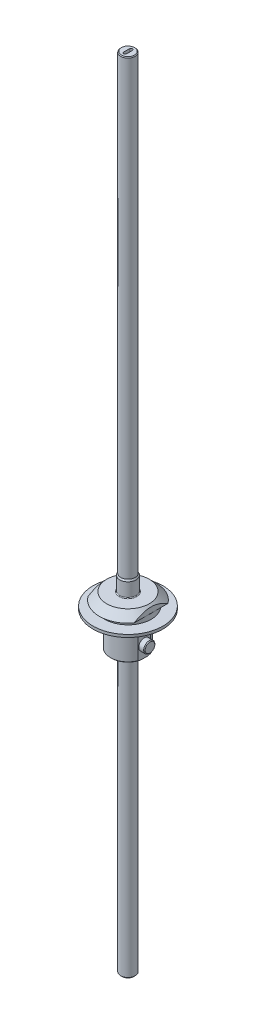
from build123d import *

# Parameters (mm, degrees)
CHAMFER1_SIZE       = 0.254
CUT_EXTRUDE3_DEPTH  = 3.81
SKETCH5_R           = 0.9525
BOSS_EXTRUDE1_DEPTH = 3.7592
CUT_EXTRUDE1_DEPTH  = 137.608260621
CHAMFER2_SIZE       = 0.127
CUT_EXTRUDE4_REACH  = 83.566
FILLET1_R           = 0.508
FILLET2_R           = 0.127


with BuildPart() as part:
    # Sketch1 → Revolve1 (revolve)
    with BuildSketch(Plane.XY, mode=Mode.PRIVATE) as revolve1_sk:
        Polygon((0, 82.4738), (1.23825, 82.4738), (1.23825, 2.5908), (3.6322, 2.5908), (4.8768, 1.3462), (3.96875, 1.3462), (3.96875, 0.4572), (5.969, 0.4572), (5.969, 0), (2.9845, 0), (2.9845, -5.842), (1.23825, -5.842), (1.23825, -53.8734), (0, -53.8734), align=None)
    revolve(revolve1_sk.sketch.rotate(Axis((0, 82.4738, 0), (0, -1, 0)), 180), axis=Axis((0, 82.4738, 0), (0, -1, 0)))

    # Chamfer1
    chamfer1_edges = [part.edges().sort_by_distance(p)[0] for p in [
        (1.23825, -53.8734, 0),
    ]]
    chamfer(chamfer1_edges, length=CHAMFER1_SIZE)

    # Sketch4 → Cut-Extrude3 (cut)
    with BuildSketch(Plane.XZ.offset(5.842)):
        with BuildLine():
            Line((-2.794, 1.049192189), (-2.794, -1.049192189))
            ThreePointArc((-2.794, -1.049192189), (-2.9845, 0), (-2.794, 1.049192189))
        make_face()
        with BuildLine():
            Line((2.794, 1.049192189), (2.794, -1.049192189))
            ThreePointArc((2.794, -1.049192189), (2.9845, 0), (2.794, 1.049192189))
        make_face()
    extrude(amount=-CUT_EXTRUDE3_DEPTH, mode=Mode.SUBTRACT)

    # Sketch5 → Boss-Extrude1 (add, symmetric)
    with BuildSketch(Plane(origin=(0, 0, 0), x_dir=(0, 0, -1), z_dir=(1, 0, 0))):
        with Locations(Location((0, -3.81, 0), (0, 0, 180))):
            Circle(SKETCH5_R)
    extrude(amount=BOSS_EXTRUDE1_DEPTH, both=True)

    # Sketch2 → Cut-Extrude1 (cut, through all)
    with BuildSketch(Plane.XZ.offset(53.8734)):
        with BuildLine():
            Line((0.254, 0.508), (0.254, -0.508))
            ThreePointArc((0.254, -0.508), (0, -0.762), (-0.254, -0.508))
            Line((-0.254, -0.508), (-0.254, 0.508))
            ThreePointArc((-0.254, 0.508), (0, 0.762), (0.254, 0.508))
        make_face()
    extrude(amount=-CUT_EXTRUDE1_DEPTH, mode=Mode.SUBTRACT)

    # Chamfer2
    chamfer2_edges = [part.edges().sort_by_distance(p)[0] for p in [
        (0, -5.842, 2.9845),
        (1.23825, 82.4738, 0),
        (0, -5.842, -2.9845),
        (-3.7592, -3.81, -0.9525),
        (3.7592, -3.81, -0.9525),
    ]]
    chamfer(chamfer2_edges, length=CHAMFER2_SIZE)

    # Sketch6 → Cut-Extrude4 (cut, up to next)
    with BuildSketch(Plane.XZ.offset(-1.3462), mode=Mode.PRIVATE) as cut_extrude4_sk1:
        with BuildLine():
            Line((-3.937, -2.878056504), (-3.937, 2.878056504))
            ThreePointArc((-3.937, 2.878056504), (-4.8768, 0), (-3.937, -2.878056504))
        make_face()
    cut_extrude4_tool1 = extrude(cut_extrude4_sk1.sketch, amount=-CUT_EXTRUDE4_REACH, mode=Mode.PRIVATE) & part.part
    # Sketch6 → Cut-Extrude4 (cut, up to next)
    with BuildSketch(Plane.XZ.offset(-1.3462), mode=Mode.PRIVATE) as cut_extrude4_sk2:
        with BuildLine():
            Line((3.937, -2.878056504), (3.937, 2.878056504))
            ThreePointArc((3.937, 2.878056504), (4.8768, 0), (3.937, -2.878056504))
        make_face()
    cut_extrude4_tool2 = extrude(cut_extrude4_sk2.sketch, amount=-CUT_EXTRUDE4_REACH, mode=Mode.PRIVATE) & part.part
    add(cut_extrude4_tool1.solids().sort_by_distance((-4.316209, 1.3462, 0))[0], mode=Mode.SUBTRACT)
    add(cut_extrude4_tool2.solids().sort_by_distance((4.316209, 1.3462, 0))[0], mode=Mode.SUBTRACT)

    # Fillet1
    fillet1_edges = [part.edges().sort_by_distance(p)[0] for p in [
        (1.23825, -5.842, 0),
    ]]
    fillet(fillet1_edges, radius=FILLET1_R)

    # Sketch7 → Revolve2 (revolve)
    with BuildSketch(Plane.XY):
        Polygon((1.23825, 5.278763066), (1.23825, 2.5908), (1.397, 2.5908), (1.397, 5.0038), align=None)
    revolve(axis=Axis((0, 0, 0), (0, 1, 0)))

    # Fillet2
    fillet2_edges = [part.edges().sort_by_distance(p)[0] for p in [
        (-1.397, 2.5908, 0),
    ]]
    fillet(fillet2_edges, radius=FILLET2_R)


solid = part.part
